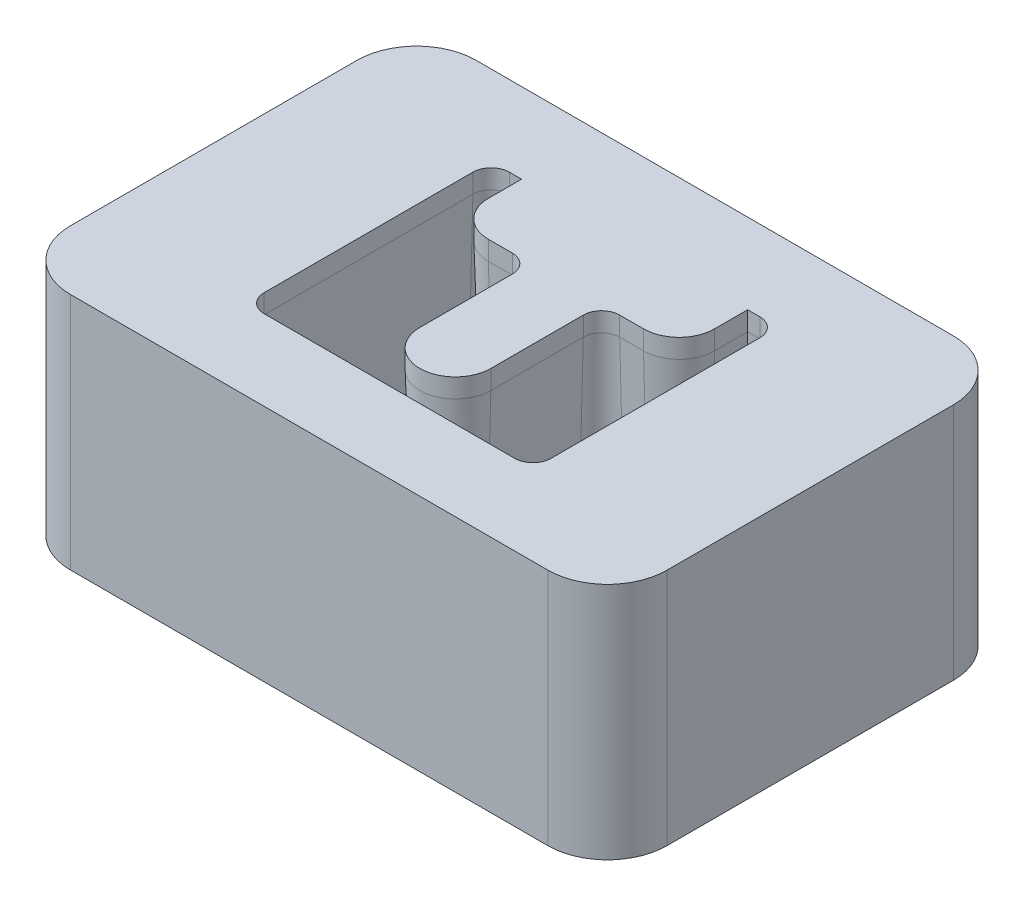
from build123d import *

# Parameters (mm, degrees)
SKETCH1_W                   = 100
SKETCH1_H                   = 68
BOSS_EXTRUDE1_DEPTH         = 40
FILLET1_R                   = 10
CUT_EXTRUDE1_REACH          = 74.498
M6_TAPPED_HOLE1_D           = 5
M6_TAPPED_HOLE1_DEPTH       = 17
M6_TAPPED_HOLE1_CSINK_D     = 6.05
M6_TAPPED_HOLE1_CSINK_ANGLE = 90
M6_TAPPED_HOLE1_TIP         = 1.502151548


with BuildPart() as part:
    # Sketch1 → Boss-Extrude1 (new body)
    with BuildSketch(Plane(origin=(0, 0, 0), x_dir=(1, 0, 0), z_dir=(0, 1, 0))):
        Rectangle(SKETCH1_W, SKETCH1_H)
    extrude(amount=-BOSS_EXTRUDE1_DEPTH)

    # Fillet1
    fillet1_edges = [part.edges().sort_by_distance(p)[0] for p in [
        (50, -20, 34),
        (-50, -20, 34),
        (-50, -20, -34),
        (50, -20, -34),
    ]]
    fillet(fillet1_edges, radius=FILLET1_R)

    # Sketch2 → Cut-Extrude1 (cut, up to next)
    with BuildSketch(Plane(origin=(0, 0, 0), x_dir=(1, 0, 0), z_dir=(0, 1, 0)), mode=Mode.PRIVATE) as cut_extrude1_sk1:
        with BuildLine():
            Line((-21, -20.55), (21, -20.55))
            ThreePointArc((21, -20.55), (23.156675683, -19.656675683), (24.05, -17.5))
            Line((24.05, -17.5), (24.05, 17.5))
            ThreePointArc((24.05, 17.5), (23.156675683, 19.656675683), (21, 20.55))
            Line((21, 20.55), (18.95, 20.55))
            Line((18.95, 20.55), (18.95, 15))
            ThreePointArc((18.95, 15), (17.207285348, 10.792714652), (13, 9.05))
            Line((13, 9.05), (9, 9.05))
            ThreePointArc((9, 9.05), (6.843324317, 8.156675683), (5.95, 6))
            Line((5.95, 6), (5.95, -9.5))
            ThreePointArc((5.95, -9.5), (0, -15.45), (-5.95, -9.5))
            Line((-5.95, -9.5), (-5.95, 6))
            ThreePointArc((-5.95, 6), (-6.843324317, 8.156675683), (-9, 9.05))
            Line((-9, 9.05), (-13, 9.05))
            ThreePointArc((-13, 9.05), (-17.207285348, 10.792714652), (-18.95, 15))
            Line((-18.95, 15), (-18.95, 20.55))
            Line((-18.95, 20.55), (-21, 20.55))
            ThreePointArc((-21, 20.55), (-23.156675683, 19.656675683), (-24.05, 17.5))
            Line((-24.05, 17.5), (-24.05, -17.5))
            ThreePointArc((-24.05, -17.5), (-23.156675683, -19.656675683), (-21, -20.55))
        make_face()
    cut_extrude1_tool1 = extrude(cut_extrude1_sk1.sketch, amount=-CUT_EXTRUDE1_REACH, mode=Mode.PRIVATE) & part.part
    add(cut_extrude1_tool1.solids().sort_by_distance((0, 0, 19.917322))[0], mode=Mode.SUBTRACT)

    # Cut-Sweep1: sweep along a path in Sketch5
    with BuildLine(Plane(origin=(0, 0, 0), x_dir=(1, 0, 0), z_dir=(0, 1, 0))) as cut_sweep1_path:
        Line((-21, -20.55), (21, -20.55))
        ThreePointArc((21, -20.55), (23.156675683, -19.656675683), (24.05, -17.5))
        Line((24.05, -17.5), (24.05, 17.5))
        ThreePointArc((24.05, 17.5), (23.156675683, 19.656675683), (21, 20.55))
        Line((21, 20.55), (18.95, 20.55))
        Line((18.95, 20.55), (18.95, 15))
        ThreePointArc((18.95, 15), (17.207285348, 10.792714652), (13, 9.05))
        Line((13, 9.05), (9, 9.05))
        ThreePointArc((9, 9.05), (6.843324317, 8.156675683), (5.95, 6))
        Line((5.95, 6), (5.95, -9.5))
        ThreePointArc((5.95, -9.5), (0, -15.45), (-5.95, -9.5))
        Line((-5.95, -9.5), (-5.95, 6))
        ThreePointArc((-5.95, 6), (-6.843324317, 8.156675683), (-9, 9.05))
        Line((-9, 9.05), (-13, 9.05))
        ThreePointArc((-13, 9.05), (-17.207285348, 10.792714652), (-18.95, 15))
        Line((-18.95, 15), (-18.95, 20.55))
        Line((-18.95, 20.55), (-21, 20.55))
        ThreePointArc((-21, 20.55), (-23.156675683, 19.656675683), (-24.05, 17.5))
        Line((-24.05, 17.5), (-24.05, -17.5))
        ThreePointArc((-24.05, -17.5), (-23.156675683, -19.656675683), (-21, -20.55))
    # Sketch3 → Cut-Sweep1 (sweep, cut)
    with BuildSketch(Plane.XY):
        Polygon((24.05, -3.2), (25.013641914, -40), (23.05, -40), (23.05, -3.2), align=None)
    sweep(path=cut_sweep1_path.line, transition=Transition.RIGHT, mode=Mode.SUBTRACT)

    # M6 Tapped Hole1
    with Locations(Plane(origin=(0, -40, 0), x_dir=(-1, 0, 0), z_dir=(0, -1, 0))):
        with Locations((-43, 27), (43, 27), (43, -27), (-43, -27)):
            CounterSinkHole(M6_TAPPED_HOLE1_D / 2, M6_TAPPED_HOLE1_CSINK_D / 2, depth=M6_TAPPED_HOLE1_DEPTH, counter_sink_angle=M6_TAPPED_HOLE1_CSINK_ANGLE)
            with Locations((0, 0, -(M6_TAPPED_HOLE1_DEPTH + M6_TAPPED_HOLE1_TIP / 2))):  # 118° drill point
                Cone(0, M6_TAPPED_HOLE1_D / 2, M6_TAPPED_HOLE1_TIP, mode=Mode.SUBTRACT)


solid = part.part
